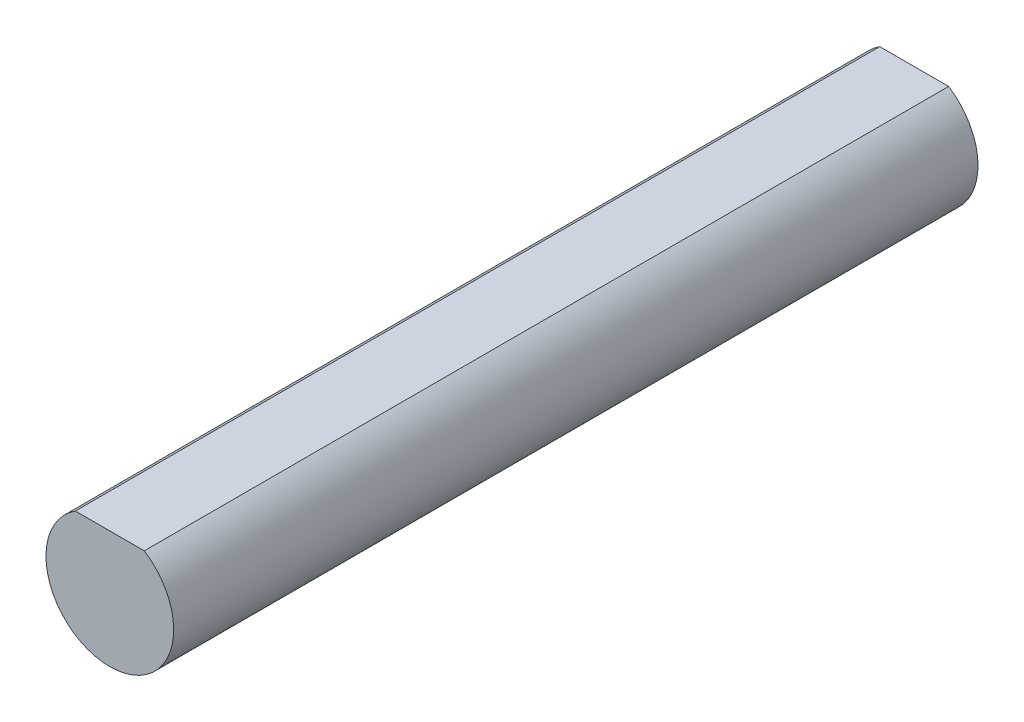
from build123d import *

# Parameters (mm, degrees)
BOSS_EXTRUDE1_DEPTH = 40


with BuildPart() as part:
    # Sketch1 → Boss-Extrude1 (new body)
    with BuildSketch(Plane.XY):
        with BuildLine():
            Line((-1.7145, 2.672286427), (1.7145, 2.672286427))
            ThreePointArc((1.7145, 2.672286427), (0, -3.175), (-1.7145, 2.672286427))
        make_face()
    extrude(amount=BOSS_EXTRUDE1_DEPTH)


solid = part.part
